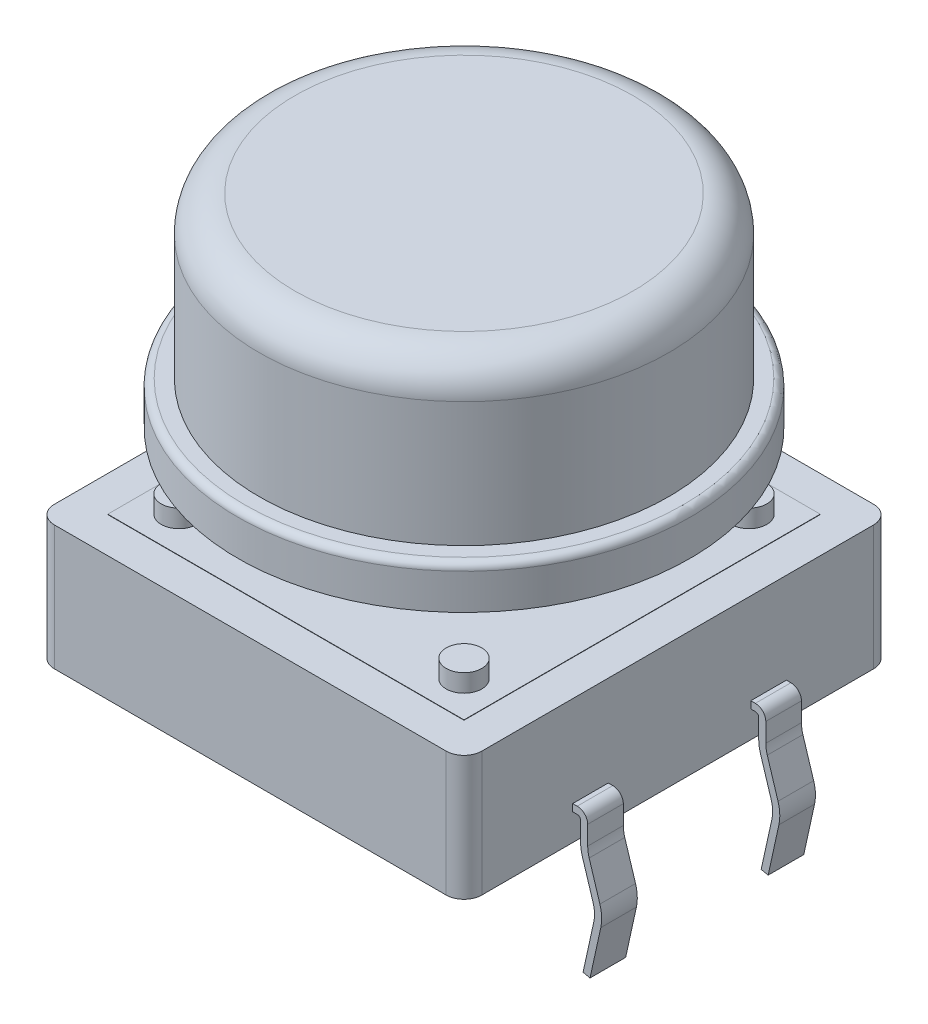
from build123d import *

# Parameters (mm, degrees)
EXTRUSION2_DEPTH = 3.5
ESQUISSE2_W      = 10
ESQUISSE2_H      = 10
EXTRUSION5_DEPTH = 0.01
ESQUISSE6_R      = 0.5
EXTRUSION6_DEPTH = 0.5
ESQUISSE7_R      = 3.05
EXTRUSION7_DEPTH = 0.8
ESQUISSE10_W     = 1
ESQUISSE10_H     = 0.2


with BuildPart() as part:
    # Esquisse1 → Extrusion2 (new body)
    with BuildSketch(Plane(origin=(0, 0, 0), x_dir=(1, 0, 0), z_dir=(0, 1, 0))):
        with BuildLine():
            Line((-5.5, -6), (5.5, -6))
            ThreePointArc((5.5, -6), (5.853553391, -5.853553391), (6, -5.5))
            Line((6, -5.5), (6, 5.5))
            ThreePointArc((6, 5.5), (5.853553391, 5.853553391), (5.5, 6))
            Line((5.5, 6), (-5.5, 6))
            ThreePointArc((-5.5, 6), (-5.853553391, 5.853553391), (-6, 5.5))
            Line((-6, 5.5), (-6, -5.5))
            ThreePointArc((-6, -5.5), (-5.853553391, -5.853553391), (-5.5, -6))
        make_face()
    extrude(amount=EXTRUSION2_DEPTH)

    # Esquisse2 → Extrusion5 (add)
    with BuildSketch(Plane(origin=(0, 3.5, 0), x_dir=(-1, 0, 0), z_dir=(0, 1, 0))):
        Rectangle(ESQUISSE2_W, ESQUISSE2_H)
    extrude(amount=EXTRUSION5_DEPTH)

    # Esquisse6 → Extrusion6 (add)
    with BuildSketch(Plane(origin=(0, 3.51, 0), x_dir=(-1, 0, 0), z_dir=(0, 1, 0))):
        with Locations(Location((4, 4, 0), (0, 0, 270))):
            Circle(ESQUISSE6_R)
        with Locations(Location((-4, 4, 0), (0, 0, 270))):
            Circle(ESQUISSE6_R)
        with Locations(Location((-4, -4, 0), (0, 0, 270))):
            Circle(ESQUISSE6_R)
        with Locations(Location((4, -4, 0), (0, 0, 270))):
            Circle(ESQUISSE6_R)
    extrude(amount=EXTRUSION6_DEPTH)

    # Esquisse7 → Extrusion7 (add)
    with BuildSketch(Plane(origin=(0, 3.51, 0), x_dir=(-1, 0, 0), z_dir=(0, 1, 0))):
        with Locations(Location((0, 0, 0), (0, 0, 270))):
            Circle(ESQUISSE7_R)
    extrude(amount=EXTRUSION7_DEPTH)

    # Esquisse11 → Révolution2 (revolve)
    with BuildSketch(Plane(origin=(0, 0, 0), x_dir=(0, 0, -1), z_dir=(1, 0, 0)), mode=Mode.PRIVATE) as r_volution2_sk:
        with BuildLine():
            Line((0, 11.31), (-4.75, 11.31))
            ThreePointArc((-4.75, 11.31), (-5.457106781, 11.017106781), (-5.75, 10.31))
            Line((-5.75, 10.31), (-5.75, 6.81))
            Line((-5.75, 6.81), (-6.15, 6.81))
            ThreePointArc((-6.15, 6.81), (-6.291421356, 6.751421356), (-6.35, 6.61))
            Line((-6.35, 6.61), (-6.35, 5.61))
            Line((-6.35, 5.61), (-2.7, 5.61))
            Line((-2.7, 5.61), (-2.7, 4.31))
            Line((-2.7, 4.31), (0, 4.31))
            Line((0, 4.31), (0, 11.31))
        make_face()
    revolve(r_volution2_sk.sketch.rotate(Axis((0, 4.31, 0), (0, 1, 0)), 180), axis=Axis((0, 4.31, 0), (0, 1, 0)))


with BuildPart() as body_2:
    # Balayage2: sweep along a curve in space
    with BuildLine() as balayage2_path:
        Line((-6.050870798, 0.906156302, 2.505204921), (-6.178164518, 0.906156302, 2.505204921))
        ThreePointArc((-6.178164518, 0.906156302, 2.505204921), (-6.319550726, 0.847612798, 2.505204921), (-6.378164494, 0.706255704, 2.505204921))
        Line((-6.378164494, 0.706255704, 2.505204921), (-6.378427935, 0.176202163, 2.505204921))
        ThreePointArc((-6.378427935, 0.176202163, 2.505204921), (-6.389851994, 0.025974739, 2.505204921), (-6.423715527, -0.120831423, 2.505204921))
        Line((-6.423715527, -0.120831423, 2.505204921), (-6.725750394, -1.089996959, 2.505204921))
        ThreePointArc((-6.725750394, -1.089996959, 2.505204921), (-6.770113321, -1.344530767, 2.505204921), (-6.747782453, -1.601934848, 2.505204921))
        Line((-6.747782453, -1.601934848, 2.505204921), (-6.445811931, -2.977578337, 2.505204921))
    # Esquisse10 → Balayage2 (sweep)
    with BuildSketch(Plane.ZY.offset(6.05)):
        with Locations((2.5, 0.9)):
            Rectangle(ESQUISSE10_W, ESQUISSE10_H)
    sweep(path=balayage2_path.line)


with BuildPart() as body_3:
    # Symétrie2: mirrored copy
    add(body_2.part.mirror(Plane(origin=(0, 0, 0), x_dir=(1, 0, 0), z_dir=(0, 0, -1))))


with BuildPart() as body_4:
    # Symétrie3: mirrored copy
    add(body_3.part.mirror(Plane.ZY))


with BuildPart() as body_5:
    # Sym_trie3 2: mirrored copy
    add(body_2.part.mirror(Plane.ZY))


solid = Compound([part.part, body_2.part, body_3.part, body_4.part, body_5.part])
